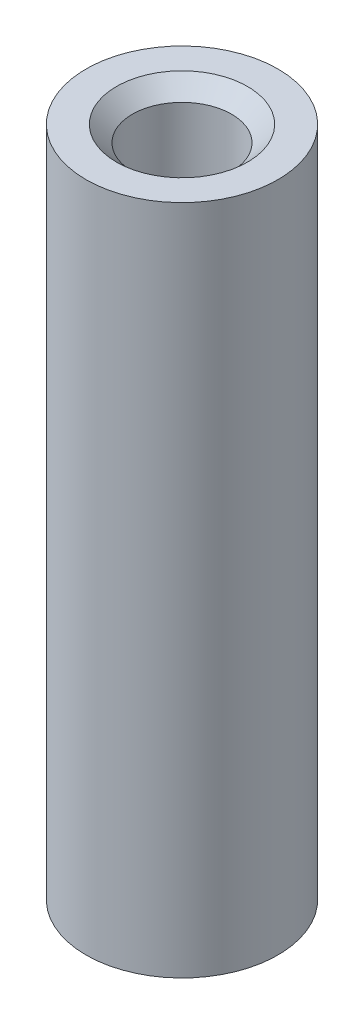
from build123d import *

# Parameters (mm, degrees)
SKIZZE1_R                       = 3
SKIZZE1_R_2                     = 1.55
AUFSATZ_LINEAR_AUSTRAGEN1_DEPTH = 21
FASE1_SIZE                      = 0.5


with BuildPart() as part:
    # Skizze1 → Aufsatz-Linear austragen1 (new body)
    with BuildSketch(Plane(origin=(0, 0, 0), x_dir=(1, 0, 0), z_dir=(0, 1, 0))):
        with Locations(Location((0, 0, 0), (0, 0, 90))):
            Circle(SKIZZE1_R)
        with Locations(Location((0, 0, 0), (0, 0, 90))):
            Circle(SKIZZE1_R_2, mode=Mode.SUBTRACT)
    extrude(amount=AUFSATZ_LINEAR_AUSTRAGEN1_DEPTH)

    # Fase1
    fase1_edges = [part.edges().sort_by_distance(p)[0] for p in [
        (0, 0, 1.55),
        (0, 21, 1.55),
    ]]
    chamfer(fase1_edges, length=FASE1_SIZE)


solid = part.part
